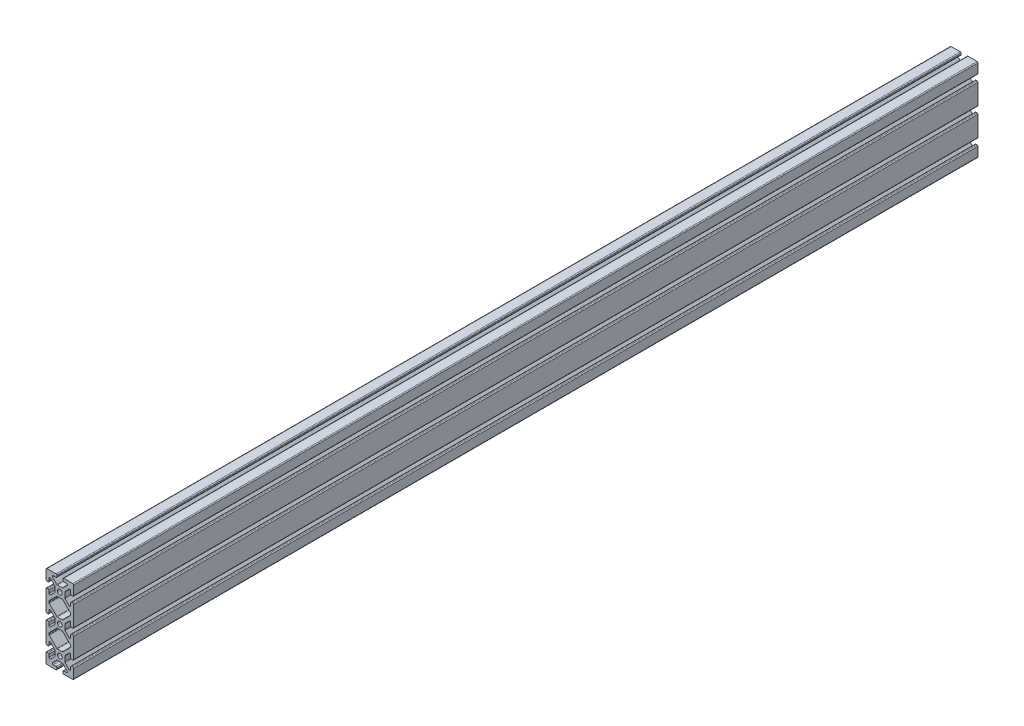
from build123d import *

# Parameters (mm, degrees)
SKETCH1_R           = 3.3274
BOSS_EXTRUDE1_DEPTH = 1244.6
FILLET1_R           = 1.27


with BuildPart() as part:
    # Sketch1 → Boss-Extrude1 (new body)
    with BuildSketch(Plane.XY):
        Polygon((-12.112318041, 14.986), (-3.882718041, 6.7564), (3.882718041, 6.7564), (12.112318041, 14.986), (4.064, 14.986), (4.064, 19.05), (19.05, 19.05), (19.05, 4.064), (14.986, 4.064), (14.986, 12.112318041), (6.7564, 3.882718041), (6.7564, -3.882718041), (14.986, -12.112318041), (14.986, -4.064), (19.05, -4.064), (19.05, -34.036), (14.986, -34.036), (14.986, -25.987681959), (6.7564, -34.217281959), (6.7564, -41.982718041), (14.986, -50.212318041), (14.986, -42.164), (19.05, -42.164), (19.05, -72.136), (14.986, -72.136), (14.986, -64.087681959), (6.7564, -72.317281959), (6.7564, -80.082718041), (14.986, -88.312318041), (14.986, -80.264), (19.05, -80.264), (19.05, -95.25), (4.064, -95.25), (4.064, -91.186), (12.112318041, -91.186), (3.882718041, -82.9564), (-3.882718041, -82.9564), (-12.112318041, -91.186), (-4.064, -91.186), (-4.064, -95.25), (-19.05, -95.25), (-19.05, -80.264), (-14.986, -80.264), (-14.986, -88.312318041), (-6.7564, -80.082718041), (-6.7564, -72.317281959), (-14.986, -64.087681959), (-14.986, -72.136), (-19.05, -72.136), (-19.05, -42.164), (-14.986, -42.164), (-14.986, -50.212318041), (-6.7564, -41.982718041), (-6.7564, -34.217281959), (-14.986, -25.987681959), (-14.986, -34.036), (-19.05, -34.036), (-19.05, -4.064), (-14.986, -4.064), (-14.986, -12.112318041), (-6.7564, -3.882718041), (-6.7564, 3.882718041), (-14.986, 12.112318041), (-14.986, 4.064), (-19.05, 4.064), (-19.05, 19.05), (-4.064, 19.05), (-4.064, 14.986), align=None)
        Circle(SKETCH1_R, mode=Mode.SUBTRACT)
        with Locations(Location((0, -38.1, 0), (0, 0, 180))):
            Circle(SKETCH1_R, mode=Mode.SUBTRACT)
        with Locations(Location((0, -76.2, 0), (0, 0, 180))):
            Circle(SKETCH1_R, mode=Mode.SUBTRACT)
        Polygon((-3.882718041, -6.7564), (-14.986, -17.859681959), (-14.986, -20.240318041), (-3.882718041, -31.3436), (3.882718041, -31.3436), (14.986, -20.240318041), (14.986, -17.859681959), (3.882718041, -6.7564), align=None, mode=Mode.SUBTRACT)
        Polygon((14.986, -58.340318041), (14.986, -55.959681959), (3.882718041, -44.8564), (-3.882718041, -44.8564), (-14.986, -55.959681959), (-14.986, -58.340318041), (-3.882718041, -69.4436), (3.882718041, -69.4436), align=None, mode=Mode.SUBTRACT)
    extrude(amount=BOSS_EXTRUDE1_DEPTH)

    # Fillet1
    fillet1_edges = [part.edges().sort_by_distance(p)[0] for p in [
        (-19.05, 19.05, 622.3),
        (-4.064, 19.05, 622.3),
        (-4.064, 14.986, 622.3),
        (-12.112318041, 14.986, 622.3),
        (-3.882718041, 6.7564, 622.3),
        (3.882718041, 6.7564, 622.3),
        (12.112318041, 14.986, 622.3),
        (4.064, 14.986, 622.3),
        (4.064, 19.05, 622.3),
        (19.05, 19.05, 622.3),
        (19.05, 4.064, 622.3),
        (14.986, 4.064, 622.3),
        (14.986, 12.112318041, 622.3),
        (6.7564, 3.882718041, 622.3),
        (6.7564, -3.882718041, 622.3),
        (14.986, -12.112318041, 622.3),
        (14.986, -4.064, 622.3),
        (19.05, -4.064, 622.3),
        (19.05, -34.036, 622.3),
        (14.986, -34.036, 622.3),
        (14.986, -25.987681959, 622.3),
        (6.7564, -34.217281959, 622.3),
        (6.7564, -41.982718041, 622.3),
        (14.986, -50.212318041, 622.3),
        (14.986, -42.164, 622.3),
        (19.05, -42.164, 622.3),
        (19.05, -72.136, 622.3),
        (14.986, -72.136, 622.3),
        (14.986, -64.087681959, 622.3),
        (6.7564, -72.317281959, 622.3),
        (6.7564, -80.082718041, 622.3),
        (14.986, -88.312318041, 622.3),
        (14.986, -80.264, 622.3),
        (19.05, -80.264, 622.3),
        (19.05, -95.25, 622.3),
        (4.064, -95.25, 622.3),
        (4.064, -91.186, 622.3),
        (12.112318041, -91.186, 622.3),
        (3.882718041, -82.9564, 622.3),
        (-3.882718041, -82.9564, 622.3),
        (-12.112318041, -91.186, 622.3),
        (-4.064, -91.186, 622.3),
        (-4.064, -95.25, 622.3),
        (-19.05, -95.25, 622.3),
        (-19.05, -80.264, 622.3),
        (-14.986, -80.264, 622.3),
        (-14.986, -88.312318041, 622.3),
        (-6.7564, -80.082718041, 622.3),
        (-6.7564, -72.317281959, 622.3),
        (-14.986, -64.087681959, 622.3),
        (-14.986, -72.136, 622.3),
        (-19.05, -72.136, 622.3),
        (-19.05, -42.164, 622.3),
        (-14.986, -42.164, 622.3),
        (-14.986, -50.212318041, 622.3),
        (-6.7564, -41.982718041, 622.3),
        (-6.7564, -34.217281959, 622.3),
        (-14.986, -25.987681959, 622.3),
        (-14.986, -34.036, 622.3),
        (-19.05, -34.036, 622.3),
        (-19.05, -4.064, 622.3),
        (-14.986, -4.064, 622.3),
        (-14.986, -12.112318041, 622.3),
        (-6.7564, -3.882718041, 622.3),
        (-6.7564, 3.882718041, 622.3),
        (-14.986, 12.112318041, 622.3),
        (-14.986, 4.064, 622.3),
        (-19.05, 4.064, 622.3),
        (14.986, -20.240318041, 622.3),
        (14.986, -17.859681959, 622.3),
        (3.882718041, -6.7564, 622.3),
        (-3.882718041, -6.7564, 622.3),
        (-14.986, -17.859681959, 622.3),
        (-14.986, -20.240318041, 622.3),
        (-3.882718041, -31.3436, 622.3),
        (3.882718041, -31.3436, 622.3),
        (3.882718041, -69.4436, 622.3),
        (14.986, -58.340318041, 622.3),
        (14.986, -55.959681959, 622.3),
        (3.882718041, -44.8564, 622.3),
        (-3.882718041, -44.8564, 622.3),
        (-14.986, -55.959681959, 622.3),
        (-14.986, -58.340318041, 622.3),
        (-3.882718041, -69.4436, 622.3),
    ]]
    fillet(fillet1_edges, radius=FILLET1_R)


solid = part.part
